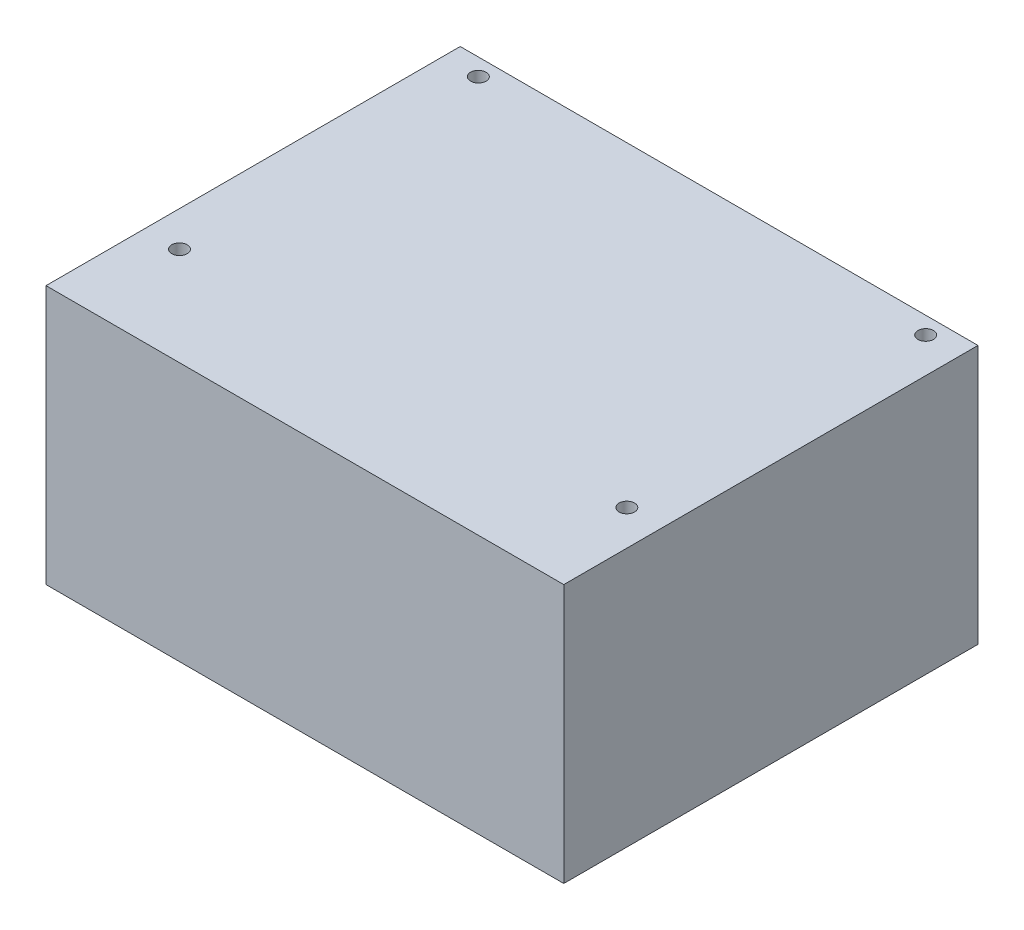
from build123d import *

# Parameters (mm, degrees)
SKETCH_1_W          = 100
SKETCH_1_H          = 80
EXTRUDE_1_DEPTH     = 50
SKETCH_2_R          = 1.5
CUT_EXTRUDE_1_DEPTH = 50


with BuildPart() as part:
    # 草图1 → 凸台-拉伸1 (new body)
    with BuildSketch(Plane(origin=(0, 0, 0), x_dir=(1, 0, 0), z_dir=(0, 1, 0))):
        Rectangle(SKETCH_1_W, SKETCH_1_H)
    extrude(amount=EXTRUDE_1_DEPTH)

    # 草图2 → 切除-拉伸1 (cut)
    with BuildSketch(Plane(origin=(0, 50, 0), x_dir=(1, 0, 0), z_dir=(0, 1, 0))):
        with Locations(Location((43.2, 36.7, 0), (0, 0, 270))):
            Circle(SKETCH_2_R)
        with Locations(Location((-43.2, 36.7, 0), (0, 0, 90))):
            Circle(SKETCH_2_R)
        with Locations(Location((43.2, -21.02, 0), (0, 0, 90))):
            Circle(SKETCH_2_R)
        with Locations(Location((-43.2, -21.02, 0), (0, 0, 270))):
            Circle(SKETCH_2_R)
    extrude(amount=-CUT_EXTRUDE_1_DEPTH, mode=Mode.SUBTRACT)


solid = part.part
